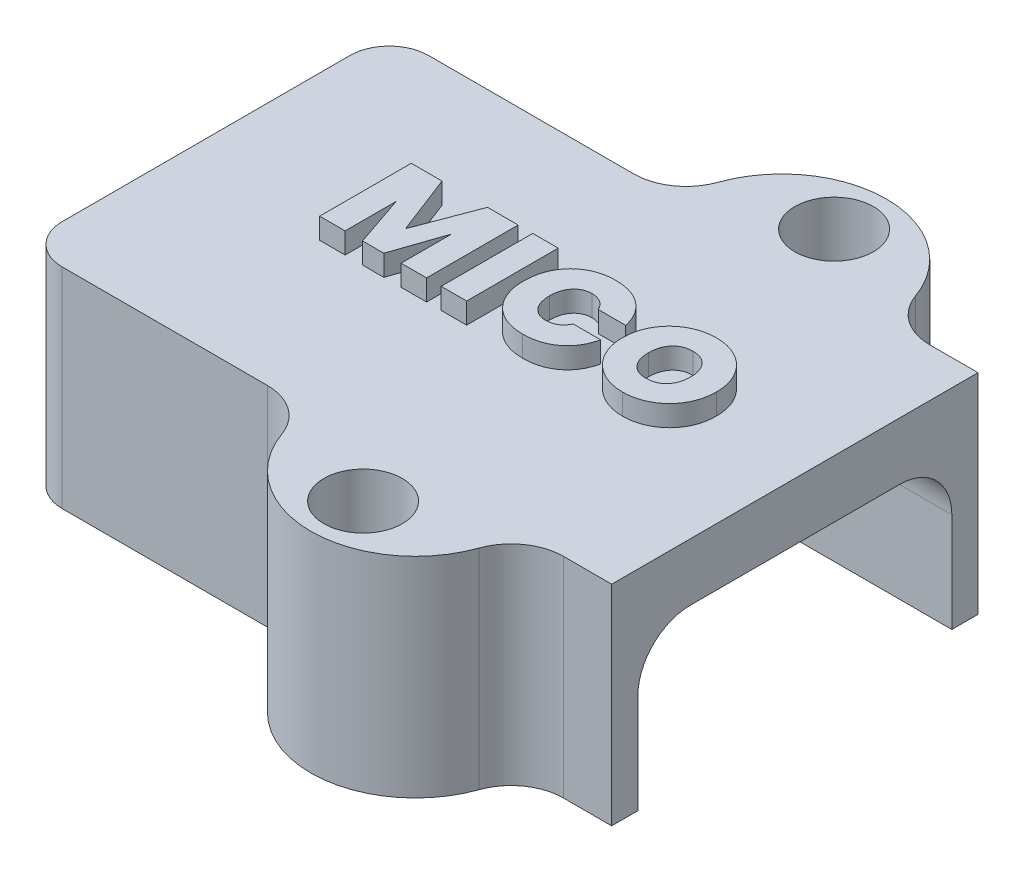
from build123d import *

# Parameters (mm, degrees)
SKETCH1_R           = 1.5
BOSS_EXTRUDE1_DEPTH = 8
SKETCH3_W           = 0.973219783
SKETCH3_H           = 3.5
BOSS_EXTRUDE2_DEPTH = 0.8
SKETCH4_W           = 12
SKETCH4_H           = 5.8
CUT_EXTRUDE2_DEPTH  = 52.484218636
FILLET1_R           = 2


with BuildPart() as part:
    # Sketch1 → Boss-Extrude1 (new body)
    with BuildSketch(Plane(origin=(0, 19.85116368, 0), x_dir=(1, 0, 0), z_dir=(0, 1, 0))):
        with BuildLine():
            Line((22.426157012, -18.379741214), (22.426157012, -32.379741214))
            Line((22.426157012, -32.379741214), (20.583011261, -32.379741214))
            ThreePointArc((20.583011261, -32.379741214), (19.428310723, -32.746748052), (18.697393178, -33.713074547))
            ThreePointArc((18.697393178, -33.713074547), (14.926157012, -36.379741214), (11.154920845, -33.713074547))
            ThreePointArc((11.154920845, -33.713074547), (10.424003301, -32.746748052), (9.269302762, -32.379741214))
            Line((9.269302762, -32.379741214), (1.426157012, -32.379741214))
            ThreePointArc((1.426157012, -32.379741214), (0.36549684, -31.940401386), (-0.073842988, -30.879741214))
            Line((-0.073842988, -30.879741214), (-0.073842988, -19.879741214))
            ThreePointArc((-0.073842988, -19.879741214), (0.36549684, -18.819081042), (1.426157012, -18.379741214))
            Line((1.426157012, -18.379741214), (9.269302762, -18.379741214))
            ThreePointArc((9.269302762, -18.379741214), (10.424003301, -18.012734376), (11.154920845, -17.04640788))
            ThreePointArc((11.154920845, -17.04640788), (14.926157012, -14.379741214), (18.697393178, -17.04640788))
            ThreePointArc((18.697393178, -17.04640788), (19.428310723, -18.012734376), (20.583011261, -18.379741214))
            Line((20.583011261, -18.379741214), (22.426157012, -18.379741214))
        make_face()
        with Locations(Location((14.926157012, -16.379741214, 0), (0, 0, 270))):
            Circle(SKETCH1_R, mode=Mode.SUBTRACT)
        with Locations(Location((14.926157012, -34.379741214, 0), (0, 0, 270))):
            Circle(SKETCH1_R, mode=Mode.SUBTRACT)
    extrude(amount=BOSS_EXTRUDE1_DEPTH)

    # Sketch3 → Boss-Extrude2 (add)
    # profile 1 of 4: a face of its own
    with BuildSketch(Plane(origin=(0, 27.85116368, 0), x_dir=(1, 0, 0), z_dir=(0, 1, 0))):
        Polygon((9.551795497, -23.078590928), (9.551795497, -26.578590928), (8.578575715, -26.578590928), (8.578575715, -24.647234474), (7.918510047, -26.578590928), (7.104022052, -26.578590928), (6.43892868, -24.632151363), (6.43892868, -26.578590928), (5.465708898, -26.578590928), (5.465708898, -23.078590928), (6.642191557, -23.078590928), (7.521321457, -25.352549475), (8.379622298, -23.078590928), align=None)
    # profile 2 of 4: a face of its own
    with BuildSketch(Plane(origin=(0, 27.85116368, 0), x_dir=(1, 0, 0), z_dir=(0, 1, 0))):
        with Locations((10.59504401, -24.828590928)):
            Rectangle(SKETCH3_W, SKETCH3_H)
    # profile 3 of 4: a face of its own
    with BuildSketch(Plane(origin=(0, 27.85116368, 0), x_dir=(1, 0, 0), z_dir=(0, 1, 0))):
        with BuildLine():
            add(Edge.make_bspline(
                [(11.506135739, -24.821049373), (11.506865087, -24.778653089), (11.508309344, -24.694699744), (11.518595393, -24.570730958), (11.534951792, -24.450050839), (11.558496881, -24.332907878), (11.589824989, -24.21945856), (11.626083146, -24.109054737), (11.67003573, -24.002482732), (11.721199789, -23.900068546), (11.777582474, -23.801663466), (11.840205645, -23.708741456), (11.908820385, -23.621547781), (11.982517396, -23.539739328), (12.06221212, -23.463600745), (12.147867707, -23.39364109), (12.238180455, -23.327691846), (12.334892216, -23.269139292), (12.435684234, -23.215927724), (12.540859813, -23.169964795), (12.649752252, -23.130854288), (12.76250473, -23.099828629), (12.878618275, -23.073899288), (12.998763867, -23.057491847), (13.122440782, -23.046036276), (13.206190403, -23.044760959), (13.248594184, -23.044115246)],
                knots=[0, 0, 0, 0, 1.090921121, 2.160247797, 3.198836581, 4.223443441, 5.232277131, 6.225889638, 7.212121003, 8.195751059, 9.170075774, 10.128690879, 11.076474727, 12.023036313, 12.959924458, 13.90968863, 14.86725387, 15.835129268, 16.816189809, 17.798313747, 18.786313932, 19.790849238, 20.805928127, 21.845375407, 22.909078879, 24, 24, 24, 24], degree=3))
            add(Edge.make_bspline(
                [(13.248594184, -23.044115246), (13.302261544, -23.045294476), (13.407437783, -23.047605506), (13.562114034, -23.063544454), (13.710226365, -23.09037334), (13.851641917, -23.129916625), (13.987186888, -23.178044734), (14.115535159, -23.239038261), (14.237472812, -23.310285122), (14.352154298, -23.392273929), (14.459089146, -23.482871137), (14.55580013, -23.582839348), (14.643011266, -23.690274751), (14.721014514, -23.805295942), (14.787943114, -23.928892279), (14.844479324, -24.06030759), (14.892645294, -24.199157604), (14.915513948, -24.295779582), (14.927128967, -24.344854011)],
                knots=[0, 0, 0, 0, 1.113135575, 2.18150124, 3.221796349, 4.231436138, 5.224276571, 6.201745712, 7.174434406, 8.150085186, 9.122368106, 10.077633641, 11.030857373, 11.989524825, 12.956211094, 13.941533538, 14.954502201, 16, 16, 16, 16], degree=3))
            Line((14.927128967, -24.344854011), (13.879211873, -24.344854011))
            add(Edge.make_bspline(
                [(13.879211873, -24.344854011), (13.862789314, -24.313247771), (13.830717963, -24.251524457), (13.769749986, -24.168752935), (13.699217158, -24.098163557), (13.620047342, -24.03972391), (13.532864922, -23.99434908), (13.439286365, -23.960699306), (13.338700457, -23.941210939), (13.269506321, -23.938825946), (13.234229316, -23.937610013)],
                knots=[0, 0, 0, 0, 1.056424033, 2.063073462, 3.038256493, 4.009362991, 4.972841785, 5.946442968, 6.953042193, 8, 8, 8, 8], degree=3))
            add(Edge.make_bspline(
                [(13.234229316, -23.937610013), (13.206646941, -23.938175794), (13.152903114, -23.93927821), (13.07453859, -23.951498612), (13.000345986, -23.969510869), (12.93070895, -23.996764868), (12.865074311, -24.030463879), (12.80345071, -24.071714516), (12.746325521, -24.120949981), (12.694509221, -24.177843572), (12.646455203, -24.239902394), (12.607049984, -24.309020967), (12.570901173, -24.381371884), (12.543404786, -24.459971516), (12.520716972, -24.542912648), (12.506511914, -24.631559367), (12.495536759, -24.724532012), (12.494809497, -24.7884531), (12.494438633, -24.821049373)],
                knots=[0, 0, 0, 0, 1.019109895, 1.985719724, 2.926230684, 3.837105113, 4.743882796, 5.649968679, 6.572811938, 7.525125039, 8.491937575, 9.468270023, 10.462147427, 11.478754545, 12.541796802, 13.637803784, 14.795408623, 16, 16, 16, 16], degree=3))
            add(Edge.make_bspline(
                [(12.494438633, -24.821049373), (12.494795026, -24.854125903), (12.495491519, -24.918766708), (12.50661299, -25.012911839), (12.52051082, -25.102337397), (12.543541792, -25.185915208), (12.570906591, -25.265011023), (12.606867242, -25.337957205), (12.646475078, -25.407213732), (12.694504, -25.469285589), (12.746326864, -25.526175771), (12.803450362, -25.575412114), (12.865074404, -25.616662522), (12.930708925, -25.650361594), (13.000345993, -25.677615577), (13.074538588, -25.695627838), (13.152903115, -25.707848239), (13.206646942, -25.708950655), (13.234229316, -25.709516436)],
                knots=[0, 0, 0, 0, 1.217704484, 2.379735683, 3.489019084, 4.548072599, 5.569165517, 6.567256767, 7.539925826, 8.503110694, 9.45185053, 10.371231102, 11.273917174, 12.177292452, 13.084749103, 14.021731083, 14.984714004, 16, 16, 16, 16], degree=3))
            add(Edge.make_bspline(
                [(13.234229316, -25.709516436), (13.269506373, -25.708300542), (13.338700612, -25.705915624), (13.439285781, -25.686426713), (13.532867025, -25.652778916), (13.620039548, -25.607396803), (13.699246569, -25.548984538), (13.769502019, -25.47842806), (13.830938499, -25.396246032), (13.862833999, -25.334629747), (13.879211873, -25.302990682)],
                knots=[0, 0, 0, 0, 1.047706149, 2.055024869, 3.02932196, 3.993489428, 4.965290051, 5.941170122, 6.942820858, 8, 8, 8, 8], degree=3))
            Line((13.879211873, -25.302990682), (14.927128967, -25.302990682))
            add(Edge.make_bspline(
                [(14.927128967, -25.302990682), (14.915542447, -25.352074831), (14.892781966, -25.448495396), (14.844317676, -25.587002021), (14.787964328, -25.718243085), (14.720999865, -25.841819403), (14.64304862, -25.956886981), (14.555557118, -26.064291148), (14.459350691, -26.164987736), (14.352119099, -26.255536789), (14.237482223, -26.337568655), (14.115532628, -26.408803989), (13.987187579, -26.469800625), (13.851641728, -26.517927885), (13.710226418, -26.557471404), (13.56211402, -26.584300224), (13.407437787, -26.60023919), (13.302261545, -26.602550218), (13.248594184, -26.603729447)],
                knots=[0, 0, 0, 0, 1.045571553, 2.053913598, 3.03930555, 4.006060013, 4.964795093, 5.918086069, 6.876988367, 7.849339876, 8.825059482, 9.797816793, 10.775354888, 11.76826536, 12.777976374, 13.818344869, 14.886785901, 16, 16, 16, 16], degree=3))
            add(Edge.make_bspline(
                [(13.248594184, -26.603729447), (13.20619036, -26.603083835), (13.122440656, -26.601808718), (12.998764352, -26.590351687), (12.878616519, -26.573949602), (12.762511093, -26.548000857), (12.649728922, -26.517046158), (12.541034971, -26.477708584), (12.435542812, -26.43275015), (12.334657592, -26.379541843), (12.238626866, -26.31996147), (12.147640321, -26.255017069), (12.061994598, -26.184934377), (11.982752022, -26.108103756), (11.908788907, -26.026329616), (11.840207587, -25.939097587), (11.777607067, -25.846170499), (11.72099021, -25.747639723), (11.670241226, -25.644783456), (11.625911163, -25.53789563), (11.589839819, -25.426934515), (11.558604171, -25.312995983), (11.534789352, -25.195184325), (11.518671656, -25.073748484), (11.508274323, -24.94859794), (11.506854633, -24.863925317), (11.506135739, -24.821049373)],
                knots=[0, 0, 0, 0, 1.088679172, 2.15019663, 3.187507745, 4.200500548, 5.202971437, 6.188941185, 7.166594588, 8.145638954, 9.114748649, 10.066759289, 11.014571603, 11.953790118, 12.898406428, 13.844242488, 14.800887546, 15.773209929, 16.760329183, 17.744533747, 18.741938946, 19.754633173, 20.777134367, 21.825771658, 22.899029122, 24, 24, 24, 24], degree=3))
        make_face()
    # profile 4 of 4: a face of its own
    with BuildSketch(Plane(origin=(0, 27.85116368, 0), x_dir=(1, 0, 0), z_dir=(0, 1, 0))):
        with BuildLine():
            add(Edge.make_bspline(
                [(17.072521949, -26.613066611), (17.032036063, -26.612389952), (16.951638417, -26.61104623), (16.832191157, -26.5998619), (16.715306152, -26.582239936), (16.600966908, -26.556636528), (16.488894859, -26.524823524), (16.379646646, -26.483898812), (16.272371848, -26.437575584), (16.168397639, -26.38352039), (16.068182305, -26.323605991), (15.973027026, -26.257493866), (15.883975886, -26.184954023), (15.798560416, -26.108502451), (15.719876002, -26.02491896), (15.646462008, -25.936228818), (15.577693915, -25.842465728), (15.514970506, -25.74304627), (15.458038567, -25.639183009), (15.409258936, -25.53130685), (15.368184224, -25.420118805), (15.33444891, -25.305648463), (15.307687507, -25.187900209), (15.289366064, -25.066660644), (15.277292046, -24.942438914), (15.27608584, -24.858426758), (15.275477008, -24.816021669)],
                knots=[0, 0, 0, 0, 1.027457631, 2.040345022, 3.042474354, 4.025911674, 5.012573142, 5.996967561, 6.984844717, 7.976899908, 8.969066769, 9.94683625, 10.914888525, 11.882883577, 12.854363136, 13.825405439, 14.8038734, 15.80362301, 16.807078105, 17.807916817, 18.805817775, 19.813386312, 20.835058856, 21.868144077, 22.923946896, 24, 24, 24, 24], degree=3))
            add(Edge.make_bspline(
                [(15.275477008, -24.816021669), (15.276085889, -24.773616602), (15.277292193, -24.689604491), (15.289365492, -24.565382435), (15.307689591, -24.444144073), (15.334441264, -24.326391414), (15.36821222, -24.211937205), (15.409080053, -24.100894317), (15.458237565, -23.993429616), (15.514947983, -23.889706617), (15.577689818, -23.790288406), (15.646499286, -23.696569973), (15.719621587, -23.607835957), (15.798854597, -23.52503053), (15.883691643, -23.44841709), (15.973318961, -23.376840346), (16.067923457, -23.310411728), (16.168651129, -23.251586214), (16.272180932, -23.197173431), (16.379674571, -23.151716324), (16.489045146, -23.111742391), (16.600847557, -23.079433093), (16.715416474, -23.055090589), (16.832174893, -23.037136483), (16.951642569, -23.026043364), (17.032037454, -23.024687303), (17.072521949, -23.024004431)],
                knots=[0, 0, 0, 0, 1.077069277, 2.133869147, 3.167929965, 4.190567328, 5.199087364, 6.197930693, 7.194177692, 8.198580403, 9.199274129, 10.178666109, 11.150625418, 12.118617686, 13.087526866, 14.052686502, 15.031379342, 16.02136737, 17.014359411, 18.000753053, 18.983990828, 19.971584052, 20.954652477, 21.957728173, 22.971572087, 24, 24, 24, 24], degree=3))
            add(Edge.make_bspline(
                [(17.072521949, -23.024004431), (17.113484861, -23.024683278), (17.194596379, -23.026027477), (17.315027098, -23.03711093), (17.432705572, -23.055221781), (17.547870556, -23.079092279), (17.659785502, -23.111903754), (17.768954707, -23.151716391), (17.876302478, -23.197007249), (17.979258181, -23.251617896), (18.079320048, -23.310377108), (18.173220423, -23.377087879), (18.262761304, -23.448175895), (18.346893946, -23.525076318), (18.425441531, -23.607842348), (18.497832695, -23.696587183), (18.56592646, -23.790307385), (18.627938356, -23.889729301), (18.683990918, -23.993430809), (18.732250315, -24.101058978), (18.773222318, -24.211931199), (18.807231421, -24.326291974), (18.832803449, -24.444250264), (18.851437339, -24.565367411), (18.863424605, -24.689608366), (18.864642632, -24.773617902), (18.86525743, -24.816021669)],
                knots=[0, 0, 0, 0, 1.041084035, 2.061472223, 3.071041691, 4.066480792, 5.048698968, 6.032405368, 7.019269139, 8.007333064, 8.992563031, 9.966735921, 10.932355565, 11.897227032, 12.861484175, 13.830033399, 14.806313925, 15.804242603, 16.806226752, 17.800437353, 18.799756744, 19.808757456, 20.830560156, 21.865113821, 22.922417377, 24, 24, 24, 24], degree=3))
            add(Edge.make_bspline(
                [(18.86525743, -24.816021669), (18.864642681, -24.858425458), (18.86342475, -24.942435036), (18.851436777, -25.066675678), (18.832805495, -25.18779398), (18.807223921, -25.305748045), (18.773249816, -25.420124313), (18.732072939, -25.531144452), (18.684184899, -25.639176947), (18.627928382, -25.743034166), (18.565877211, -25.842408851), (18.497944289, -25.936472537), (18.424382268, -26.024636455), (18.346512234, -26.108753377), (18.261027283, -26.184915742), (18.172028612, -26.257505868), (18.076855689, -26.323596501), (17.976658074, -26.38354651), (17.872825715, -26.437379924), (17.765954562, -26.484079975), (17.656852174, -26.524780639), (17.544585875, -26.556767694), (17.43018082, -26.582056562), (17.313345821, -26.599945223), (17.193882441, -26.611053426), (17.113246602, -26.612391051), (17.072521949, -26.613066611)],
                knots=[0, 0, 0, 0, 1.076827258, 2.133389664, 3.167218127, 4.188304562, 5.196597983, 6.19521687, 7.194280065, 8.195561842, 9.192790992, 10.168387163, 11.140128072, 12.108132088, 13.076823553, 14.045572283, 15.024045209, 16.016925874, 17.009694788, 17.992711629, 18.977814259, 19.96518557, 20.955268699, 21.952108375, 22.965724476, 24, 24, 24, 24], degree=3))
        make_face()
        with BuildLine():
            add(Edge.make_bspline(
                [(17.072521949, -25.709516436), (17.102723304, -25.708897453), (17.161919581, -25.707684212), (17.248115179, -25.696137048), (17.329349015, -25.676505545), (17.405711949, -25.650013702), (17.477513646, -25.616247569), (17.544088653, -25.573999803), (17.605984905, -25.524585034), (17.661982523, -25.467177039), (17.713186119, -25.404384291), (17.75682962, -25.33520018), (17.793688112, -25.260929715), (17.824732016, -25.182009779), (17.84840043, -25.097531266), (17.864571995, -25.008053142), (17.874873899, -24.913702594), (17.876250204, -24.849088395), (17.876954537, -24.816021669)],
                knots=[0, 0, 0, 0, 1.067089171, 2.09155204, 3.066481157, 4.016560595, 4.943945447, 5.864276661, 6.797319754, 7.73678768, 8.693626662, 9.656136735, 10.621173085, 11.620620688, 12.649338655, 13.716562035, 14.831436133, 16, 16, 16, 16], degree=3))
            add(Edge.make_bspline(
                [(17.876954537, -24.816021669), (17.876246668, -24.782237853), (17.874862837, -24.716192954), (17.864622983, -24.61992154), (17.84845704, -24.529009442), (17.82490169, -24.443748959), (17.79344983, -24.364531176), (17.757258042, -24.289897134), (17.712929055, -24.221110413), (17.661982388, -24.158426091), (17.606213245, -24.100938761), (17.543840698, -24.052374857), (17.477550013, -24.009992228), (17.405688179, -23.97635758), (17.329461012, -23.949564642), (17.247998071, -23.931132471), (17.161936272, -23.919261479), (17.102728943, -23.918094553), (17.072521949, -23.917499198)],
                knots=[0, 0, 0, 0, 1.18883488, 2.324085585, 3.403324648, 4.435760984, 5.430939693, 6.399398042, 7.350695849, 8.303447928, 9.238903148, 10.162711262, 11.079111508, 12.002535262, 12.948556669, 13.917381511, 14.937468638, 16, 16, 16, 16], degree=3))
            add(Edge.make_bspline(
                [(17.072521949, -23.917499198), (17.041832232, -23.918063216), (16.982138403, -23.919160274), (16.895175916, -23.931329201), (16.813132127, -23.949317639), (16.736479838, -23.976371596), (16.66464976, -24.010023229), (16.598376606, -24.052136865), (16.536671683, -24.101222496), (16.480876551, -24.158188708), (16.430640078, -24.221144697), (16.387195665, -24.290113444), (16.350710969, -24.364360811), (16.320154386, -24.443805871), (16.297478857, -24.529114608), (16.281086052, -24.619909328), (16.270913607, -24.716196243), (16.269520314, -24.782238966), (16.268807605, -24.816021669)],
                knots=[0, 0, 0, 0, 1.078588718, 2.097936879, 3.082471155, 4.02780725, 4.950562063, 5.866298455, 6.782847408, 7.71762497, 8.664422376, 9.610508143, 10.578264927, 11.569688157, 12.59914077, 13.677598016, 14.812026329, 16, 16, 16, 16], degree=3))
            add(Edge.make_bspline(
                [(16.268807605, -24.816021669), (16.269508296, -24.849566476), (16.27087292, -24.91489637), (16.281152689, -25.010213652), (16.297449684, -25.100071506), (16.320289952, -25.184846245), (16.350688118, -25.264102722), (16.387235155, -25.33830943), (16.430407927, -25.407252061), (16.48112115, -25.469595718), (16.536672794, -25.526483969), (16.598164776, -25.575704066), (16.664879363, -25.616861721), (16.736448212, -25.650695053), (16.813141069, -25.677683571), (16.895173399, -25.695690493), (16.982139085, -25.707854261), (17.041832463, -25.708952045), (17.072521949, -25.709516436)],
                knots=[0, 0, 0, 0, 1.183449987, 2.30481765, 3.378522997, 4.403220538, 5.397914201, 6.368863349, 7.318069994, 8.261394005, 9.199255143, 10.118827539, 11.033107389, 11.958906117, 12.907360617, 13.895142602, 14.917853314, 16, 16, 16, 16], degree=3))
        make_face(mode=Mode.SUBTRACT)
    extrude(amount=BOSS_EXTRUDE2_DEPTH)

    # Sketch4 → Cut-Extrude2 (cut, through all)
    with BuildSketch(Plane.ZY.offset(0.073842988)):
        with Locations((25.379741214, 22.75116368)):
            Rectangle(SKETCH4_W, SKETCH4_H)
    extrude(amount=-CUT_EXTRUDE2_DEPTH, mode=Mode.SUBTRACT)

    # Fillet1
    fillet1_edges = [part.edges().sort_by_distance(p)[0] for p in [
        (11.21905023, 25.65116368, 19.379741214),
        (11.21905023, 25.65116368, 31.379741214),
    ]]
    fillet(fillet1_edges, radius=FILLET1_R)


solid = part.part
